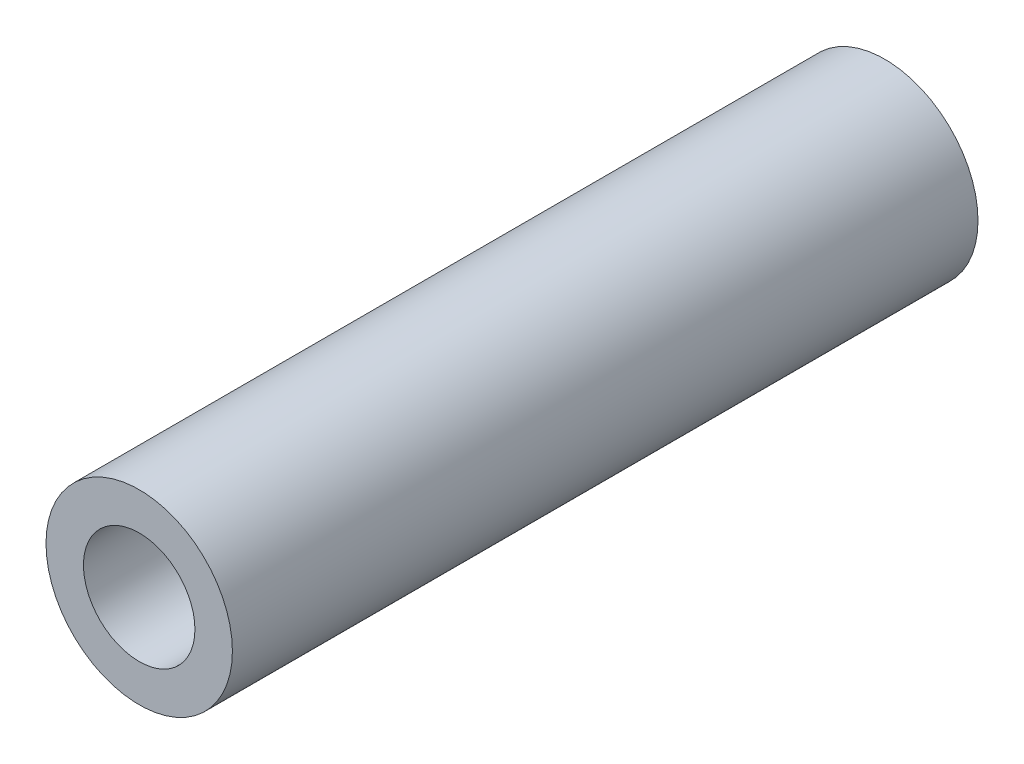
from build123d import *

# Parameters (mm, degrees)
SKETCH1_R             = 3.175
BODY_DEPTH            = 25.4
F_6_CLEARANCE_HOLE1_D = 3.7973


with BuildPart() as part:
    # Sketch1 → Body (new body)
    with BuildSketch(Plane.XY):
        Circle(SKETCH1_R)
    extrude(amount=-BODY_DEPTH)

    # #6 Clearance Hole1 (through all)
    with Locations(Plane.XY):
        with Locations((0, 0)):
            Hole(F_6_CLEARANCE_HOLE1_D / 2)


solid = part.part
